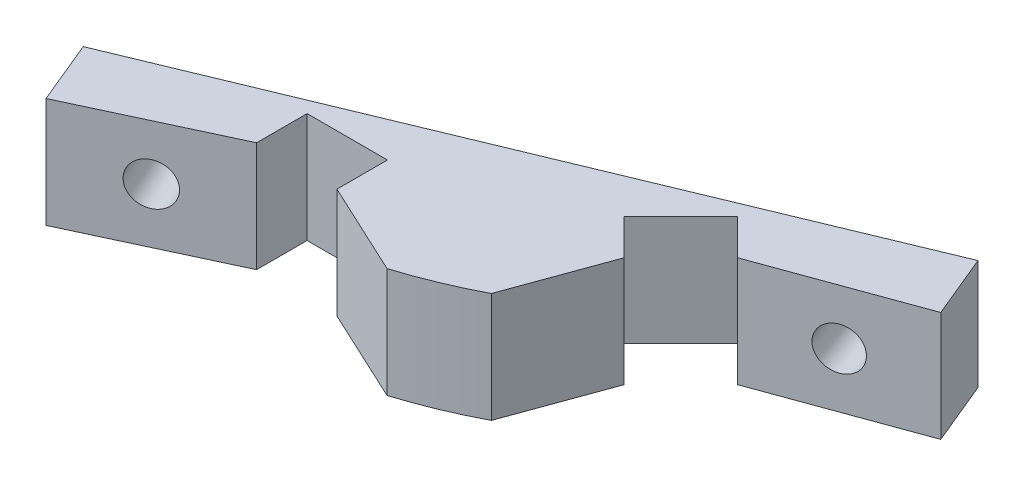
from build123d import *

# Parameters (mm, degrees)
BOSS_EXTRUDE2_DEPTH = 7.62
CUT_EXTRUDE3_DEPTH  = 2.159
BOSS_EXTRUDE5_DEPTH = 7.62
SKETCH26_R          = 1.4732
CUT_EXTRUDE4_DEPTH  = 28.462559415


with BuildPart() as part:
    # Sketch2 → Boss-Extrude2 (new body)
    with BuildSketch(Plane(origin=(0, 0, 0), x_dir=(1, 0, 0), z_dir=(0, 1, 0))):
        with BuildLine():
            Line((-2.785, -18.89), (-2.785, -22.39))
            Line((-2.785, -22.39), (-9.28719522, -25.422023426))
            Line((-9.28719522, -25.422023426), (-6.46004312, -16.395532832))
            Line((-6.46004312, -16.395532832), (19.152394428, -5.786513834))
            Line((19.152394428, -5.786513834), (27.534185559, -10.170108122))
            Line((27.534185559, -10.170108122), (20.792474901, -12.62389013))
            Line((20.792474901, -12.62389013), (18.317601167, -10.149016395))
            Line((18.317601167, -10.149016395), (16.348308781, -12.118308781))
            Line((16.348308781, -12.118308781), (14.379016395, -14.087601167))
            Line((14.379016395, -14.087601167), (16.85389013, -16.562474901))
            Line((16.85389013, -16.562474901), (14.400108122, -23.304185559))
            ThreePointArc((14.400108122, -23.304185559), (11.890895434, -24.477161025), (9.28719522, -25.422023426))
            Line((9.28719522, -25.422023426), (2.785, -22.39))
            Line((2.785, -22.39), (2.785, -18.89))
            Line((2.785, -18.89), (0, -18.89))
            Line((0, -18.89), (-2.785, -18.89))
        make_face()
    extrude(amount=BOSS_EXTRUDE2_DEPTH)

    # Sketch15 → Cut-Extrude3 (cut)
    with BuildSketch(Plane(origin=(0, 7.62, 0), x_dir=(-1, 0, 0), z_dir=(0, 1, 0))):
        Polygon((-22.217905164, 7.389745786), (7.494030365, 19.696832446), (6.459424884, 16.393558936), (-19.150561514, 5.785555238), align=None)
    extrude(amount=-CUT_EXTRUDE3_DEPTH, mode=Mode.SUBTRACT)

    # Sketch22 → Boss-Extrude5 (add)
    with BuildSketch(Plane(origin=(0, 7.62, 0), x_dir=(1, 0, 0), z_dir=(0, 1, 0))):
        Polygon((-9.28719522, -25.422023426), (-7.494030365, -19.696832446), (-14.565383767, -22.625882929), (-12.740227889, -27.032199003), align=None)
        Polygon((31.114414444, -8.867011376), (27.534185559, -10.170108122), (22.217905164, -7.389745786), (29.289258566, -4.460695302), align=None)
    extrude(amount=-BOSS_EXTRUDE5_DEPTH)

    # Sketch26 → Cut-Extrude4 (cut, through all)
    with BuildSketch(Plane(origin=(8.078449287, 0, 17.324290403), x_dir=(0.9063077870366507, 0, -0.422618261740698), z_dir=(0.422618261740698, 0, 0.9063077870366508))):
        with Locations((-17.478679383, 3.81)):
            Circle(SKETCH26_R)
    cut_extrude4 = extrude(amount=-CUT_EXTRUDE4_DEPTH, mode=Mode.SUBTRACT)

    # Mirror2: Cut-Extrude4 across plane
    add(cut_extrude4.mirror(Plane(origin=(9.626416417, 7.62, 19.01022507), x_dir=(0.38268343236517965, 0, 0.9238795325112495), z_dir=(-0.9238795325112495, 0, 0.38268343236517965))), mode=Mode.SUBTRACT)


solid = part.part
